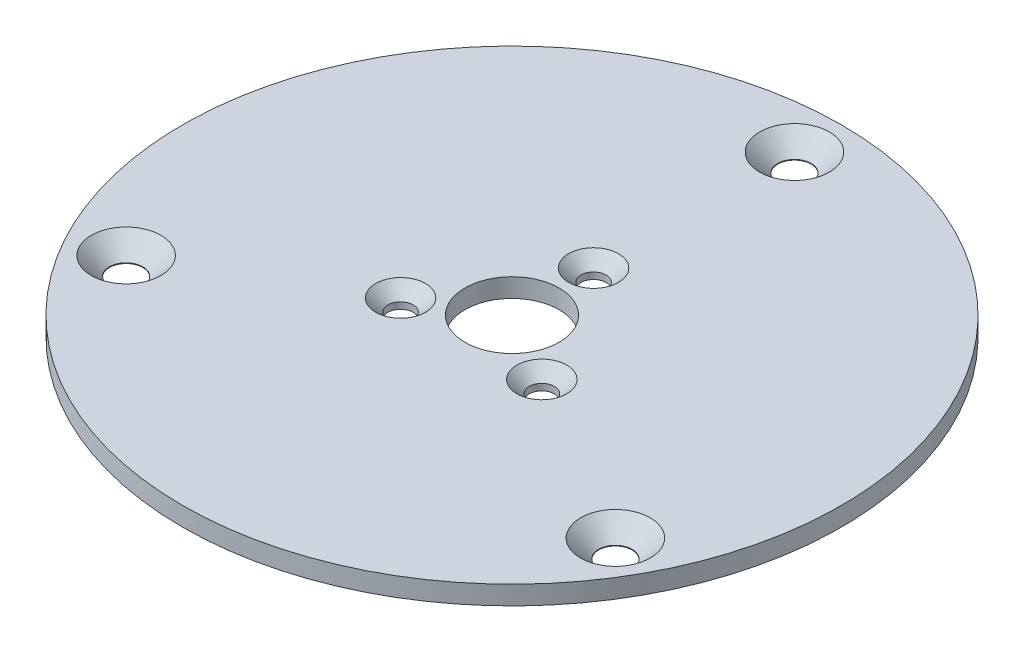
from build123d import *

# Parameters (mm, degrees)
SKETCH1_R                                      = 44.45
BOSS_EXTRUDE1_DEPTH                            = 2.54
CSK_FOR_M4_FLAT_HEAD_MACHINE_SCREW1_AT_2_COUNT = 2
CSK_FOR_M4_FLAT_HEAD_MACHINE_SCREW1_AT_2_PITCH = 65.991135768
CSK_FOR_M4_FLAT_HEAD_MACHINE_SCREW1_AT_3_COUNT = 2
CSK_FOR_M4_FLAT_HEAD_MACHINE_SCREW1_AT_3_PITCH = 65.991135768
SKETCH11_R                                     = 6.35
CUT_EXTRUDE1_DEPTH                             = 63.913087669
CSK_FOR_M3_SFHCS1_AT_2_COUNT                   = 2
CSK_FOR_M3_SFHCS1_AT_2_PITCH                   = 19.052558883
CSK_FOR_M3_SFHCS1_AT_3_COUNT                   = 2
CSK_FOR_M3_SFHCS1_AT_3_PITCH                   = 19.052558883


with BuildPart() as part:
    # Sketch1 → Boss-Extrude1 (new body)
    with BuildSketch(Plane(origin=(0, 0, 0), x_dir=(1, 0, 0), z_dir=(0, 1, 0))):
        with Locations(Location((0, 0, 0), (0, 0, 270))):
            Circle(SKETCH1_R)
    extrude(amount=BOSS_EXTRUDE1_DEPTH)

    # Sketch8 → CSK for M4 Flat Head Machine Screw1 (revolve, cut)
    with BuildSketch(Plane(origin=(0, 2.54, -38.1), x_dir=(0, 0, 1), z_dir=(1, 0, 0))):
        Polygon((0, 0), (0, 2.54), (2.25, 2.54), (2.25, 2.45), (4.7, 0), align=None)
    csk_for_m4_flat_head_machine_screw1 = revolve(axis=Axis((0, 8.89, -38.1), (0, -1, 0)), mode=Mode.SUBTRACT)

    # CSK for M4 Flat Head Machine Screw1 at 2: CSK for M4 Flat Head Machine Screw1 ×2
    with Locations(*[Vector(-0.5000000000000039, 0, 0.8660254037844365) * (i * CSK_FOR_M4_FLAT_HEAD_MACHINE_SCREW1_AT_2_PITCH) for i in range(1, CSK_FOR_M4_FLAT_HEAD_MACHINE_SCREW1_AT_2_COUNT)]):
        add(csk_for_m4_flat_head_machine_screw1, mode=Mode.SUBTRACT)

    # CSK for M4 Flat Head Machine Screw1 at 3: CSK for M4 Flat Head Machine Screw1 ×2
    with Locations(*[Vector(0.4999999999999982, 0, 0.8660254037844397) * (i * CSK_FOR_M4_FLAT_HEAD_MACHINE_SCREW1_AT_3_PITCH) for i in range(1, CSK_FOR_M4_FLAT_HEAD_MACHINE_SCREW1_AT_3_COUNT)]):
        add(csk_for_m4_flat_head_machine_screw1, mode=Mode.SUBTRACT)

    # Sketch11 → Cut-Extrude1 (cut, through all)
    with BuildSketch(Plane(origin=(0, 2.54, 0), x_dir=(1, 0, 0), z_dir=(0, 1, 0))):
        with Locations(Location((0, 0, 0), (0, 0, 270))):
            Circle(SKETCH11_R)
    extrude(amount=-CUT_EXTRUDE1_DEPTH, mode=Mode.SUBTRACT)

    # Sketch13 → CSK for M3 SFHCS1 (revolve, cut)
    with BuildSketch(Plane(origin=(0, 2.54, -11), x_dir=(0, 0, 1), z_dir=(1, 0, 0))):
        Polygon((0, 0), (0, 2.54), (1.7, 2.54), (1.7, 1.66), (3.36, 0), align=None)
    csk_for_m3_sfhcs1 = revolve(axis=Axis((0, 8.89, -11), (0, -1, 0)), mode=Mode.SUBTRACT)

    # CSK for M3 SFHCS1 at 2: CSK for M3 SFHCS1 ×2
    with Locations(*[Vector(-0.5, 0, 0.8660254037844387) * (i * CSK_FOR_M3_SFHCS1_AT_2_PITCH) for i in range(1, CSK_FOR_M3_SFHCS1_AT_2_COUNT)]):
        add(csk_for_m3_sfhcs1, mode=Mode.SUBTRACT)

    # CSK for M3 SFHCS1 at 3: CSK for M3 SFHCS1 ×2
    with Locations(*[Vector(0.5, 0, 0.8660254037844387) * (i * CSK_FOR_M3_SFHCS1_AT_3_PITCH) for i in range(1, CSK_FOR_M3_SFHCS1_AT_3_COUNT)]):
        add(csk_for_m3_sfhcs1, mode=Mode.SUBTRACT)


solid = part.part
